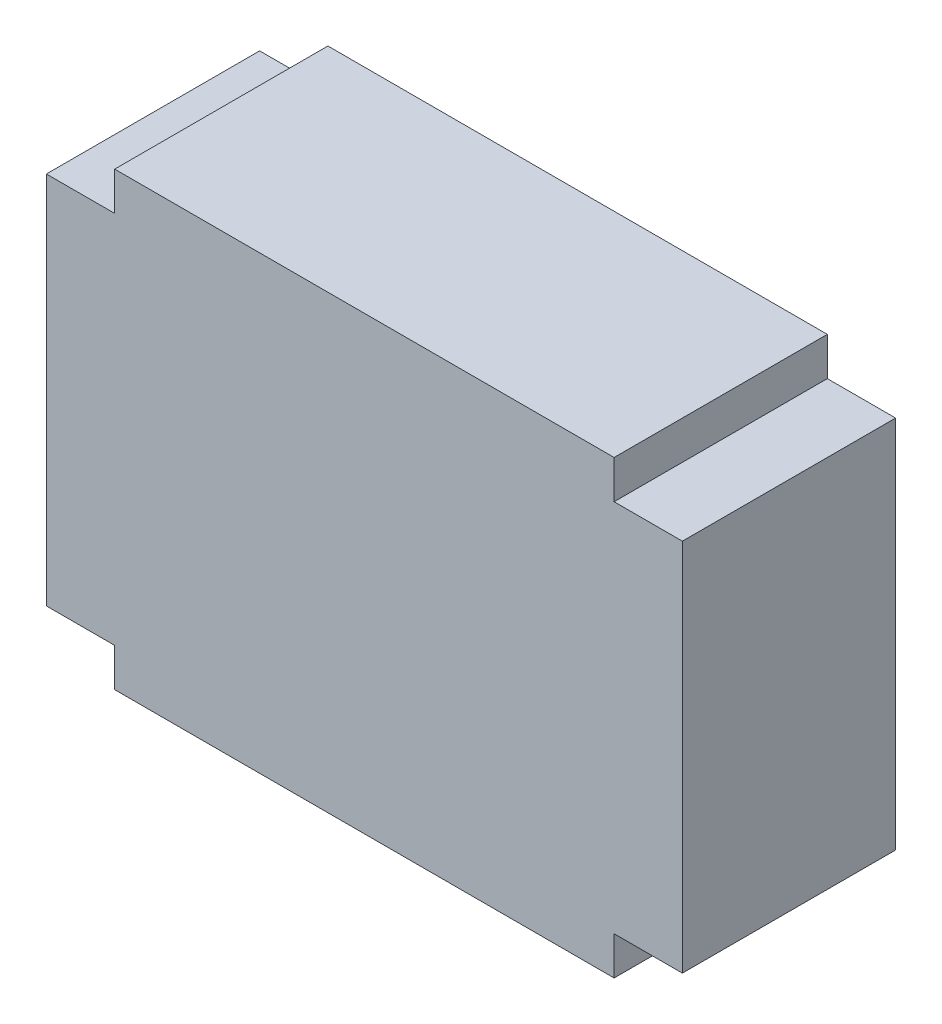
from build123d import *

# Parameters (mm, degrees)
COMPONENT_OUTLINE_DEPTH = 1.14


with BuildPart() as part:
    # 草图1 → Component_Outline (new body)
    with BuildSketch(Plane.XY):
        Polygon((-1.7, 1), (-1.335, 1), (-1.335, 1.205), (1.335, 1.205), (1.335, 1), (1.7, 1), (1.7, -1), (1.335, -1), (1.335, -1.205), (-1.335, -1.205), (-1.335, -1), (-1.7, -1), align=None)
    extrude(amount=COMPONENT_OUTLINE_DEPTH)


solid = part.part
